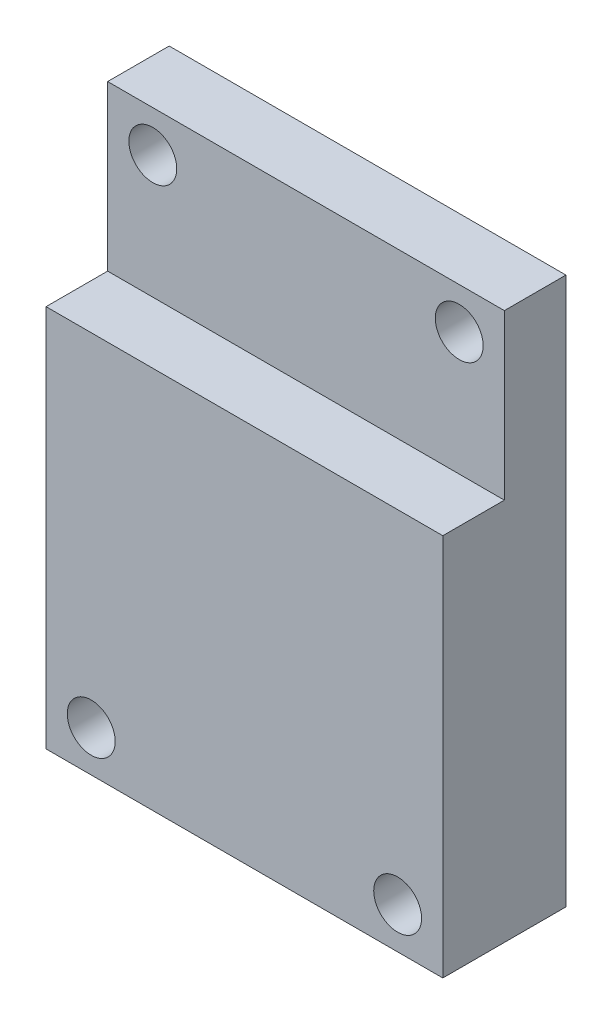
from build123d import *

# Parameters (mm, degrees)
SKETCH_1_W          = 29
SKETCH_1_H          = 40
SKETCH_1_R          = 1.75
EXTRUDE_1_DEPTH     = 9
SKETCH_3_W          = 29
SKETCH_3_H          = 12
CUT_EXTRUDE_2_DEPTH = 5


with BuildPart() as part:
    # 스케치1 → 보스-돌출1 (new body)
    with BuildSketch(Plane.XY):
        Rectangle(SKETCH_1_W, SKETCH_1_H)
        with Locations((11.199423754, 17)):
            Circle(SKETCH_1_R, mode=Mode.SUBTRACT)
        with Locations((-11.199423754, 17)):
            Circle(SKETCH_1_R, mode=Mode.SUBTRACT)
        with Locations(Location((11.199423754, -17, 0), (0, 0, 180))):
            Circle(SKETCH_1_R, mode=Mode.SUBTRACT)
        with Locations(Location((-11.199423754, -17, 0), (0, 0, 180))):
            Circle(SKETCH_1_R, mode=Mode.SUBTRACT)
    extrude(amount=EXTRUDE_1_DEPTH)

    # 스케치3 → 컷-돌출2 (cut)
    with BuildSketch(Plane(origin=(0, 0, 4.5), x_dir=(-1, 0, 0), z_dir=(0, 0, -1))):
        with Locations((0, 14)):
            Rectangle(SKETCH_3_W, SKETCH_3_H)
    extrude(amount=-CUT_EXTRUDE_2_DEPTH, mode=Mode.SUBTRACT)


solid = part.part
